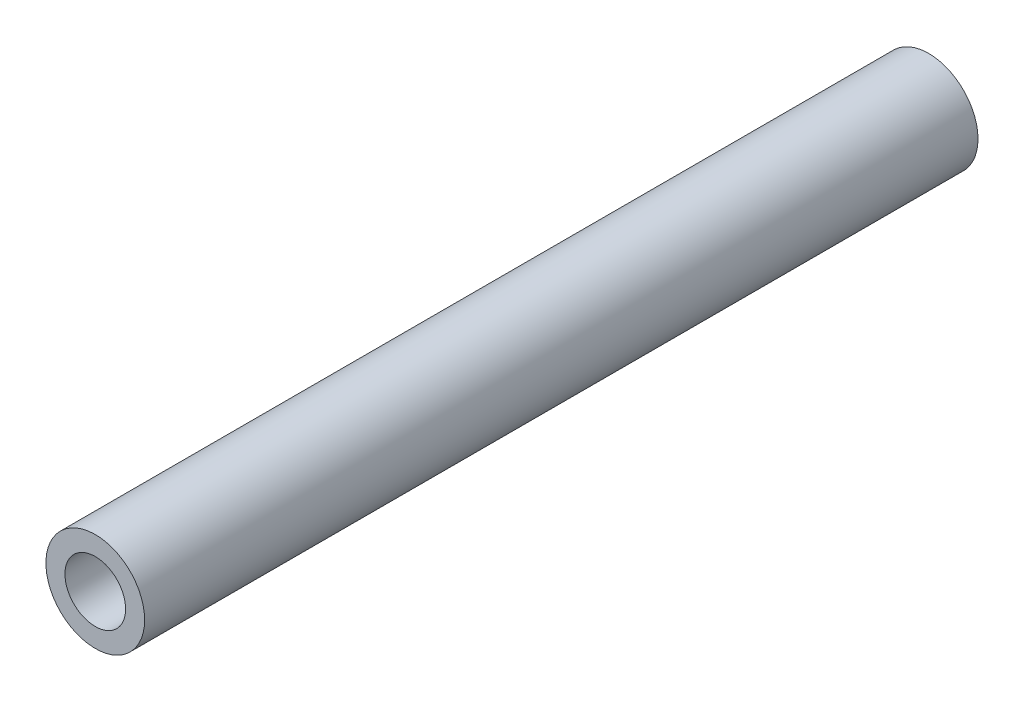
from build123d import *

# Parameters (mm, degrees)
SKETCH1_R      = 3.96875
SKETCH1_R_2    = 2.4384
EXTRUDE1_DEPTH = 33.5026


with BuildPart() as part:
    # Sketch1 → Extrude1 (new, symmetric)
    with BuildSketch(Plane.XY):
        Circle(SKETCH1_R)
        Circle(SKETCH1_R_2, mode=Mode.SUBTRACT)
    extrude(amount=EXTRUDE1_DEPTH, both=True)


solid = part.part
